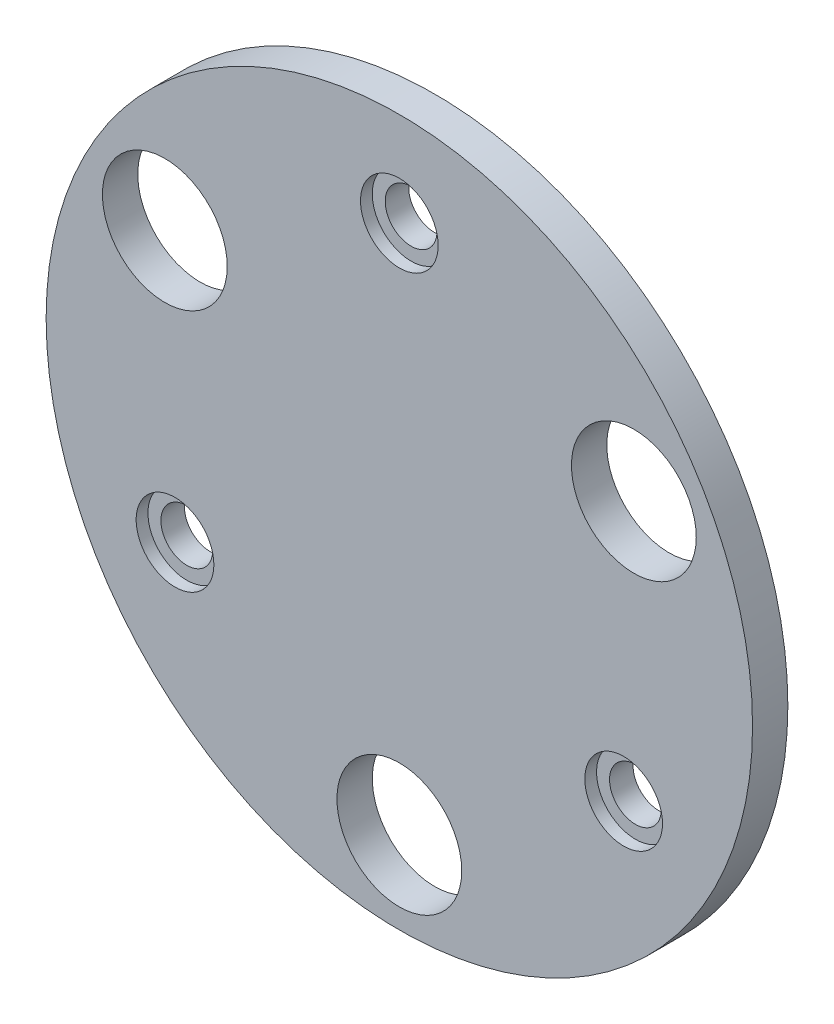
from build123d import *

# Parameters (mm, degrees)
SKETCH1_R           = 15
SKETCH1_R_2         = 1.65
SKETCH1_R_3         = 2.65
SKETCH1_R_4         = 1.1
BOSS_EXTRUDE1_DEPTH = 1.5
CUT_EXTRUDE1_START  = 1
SKETCH1_5_R         = 1.65
SKETCH1_5_R_2       = 1.1
CUT_EXTRUDE1_DEPTH  = 0.5


with BuildPart() as part:
    # Sketch1 → Boss-Extrude1 (new body)
    # profile 1 of 4: a face of its own
    with BuildSketch(Plane.XY):
        Circle(SKETCH1_R)
        with Locations((-9.526279442, -5.5)):
            Circle(SKETCH1_R_2, mode=Mode.SUBTRACT)
        with Locations((9.526279442, -5.5)):
            Circle(SKETCH1_R_2, mode=Mode.SUBTRACT)
        with Locations((0, 11)):
            Circle(SKETCH1_R_2, mode=Mode.SUBTRACT)
        with Locations((-9.959292144, 5.75)):
            Circle(SKETCH1_R_3, mode=Mode.SUBTRACT)
        with Locations((0, -11.5)):
            Circle(SKETCH1_R_3, mode=Mode.SUBTRACT)
        with Locations((9.959292144, 5.75)):
            Circle(SKETCH1_R_3, mode=Mode.SUBTRACT)
    # profile 2 of 4: a face of its own
    with BuildSketch(Plane.XY):
        with Locations((9.526279442, -5.5)):
            Circle(SKETCH1_R_2)
        with Locations((9.526279442, -5.5)):
            Circle(SKETCH1_R_4, mode=Mode.SUBTRACT)
    # profile 3 of 4: a face of its own
    with BuildSketch(Plane.XY):
        with Locations((0, 11)):
            Circle(SKETCH1_R_2)
        with Locations((0, 11)):
            Circle(SKETCH1_R_4, mode=Mode.SUBTRACT)
    # profile 4 of 4: a face of its own
    with BuildSketch(Plane.XY):
        with Locations((-9.526279442, -5.5)):
            Circle(SKETCH1_R_2)
        with Locations((-9.526279442, -5.5)):
            Circle(SKETCH1_R_4, mode=Mode.SUBTRACT)
    extrude(amount=BOSS_EXTRUDE1_DEPTH)

    # Sketch1<5> → Cut-Extrude1 (cut)
    # profile 1 of 3: a face of its own
    with BuildSketch(Plane.XY.offset(CUT_EXTRUDE1_START)):
        with Locations((-9.526279442, -5.5)):
            Circle(SKETCH1_5_R)
        with Locations((-9.526279442, -5.5)):
            Circle(SKETCH1_5_R_2, mode=Mode.SUBTRACT)
    # profile 2 of 3: a face of its own
    with BuildSketch(Plane.XY.offset(CUT_EXTRUDE1_START)):
        with Locations((0, 11)):
            Circle(SKETCH1_5_R)
        with Locations((0, 11)):
            Circle(SKETCH1_5_R_2, mode=Mode.SUBTRACT)
    # profile 3 of 3: a face of its own
    with BuildSketch(Plane.XY.offset(CUT_EXTRUDE1_START)):
        with Locations((9.526279442, -5.5)):
            Circle(SKETCH1_5_R)
    extrude(amount=CUT_EXTRUDE1_DEPTH, mode=Mode.SUBTRACT)


solid = part.part
